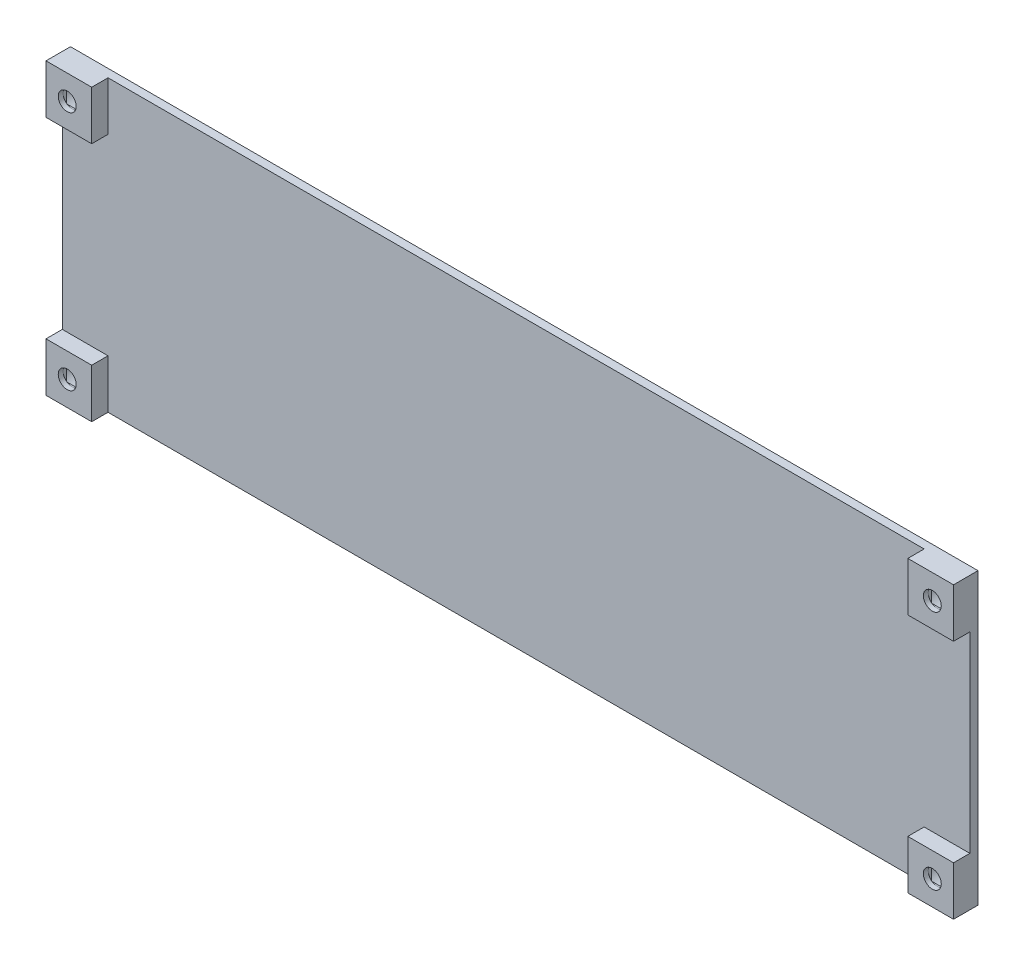
from build123d import *
from build123d.topology import SkipClean

# Parameters (mm, degrees)
SKETCH1_W               = 112
SKETCH1_H               = 35.5
BOSS_EXTRUDE1_DEPTH     = 1
SKETCH2_W               = 6
SKETCH2_H               = 6
BOSS_EXTRUDE2_DEPTH     = 2
SKETCH3_R               = 1.1
CUT_EXTRUDE1_DEPTH      = 59.822295943
SKETCH4_R               = 2
CUT_EXTRUDE2_DEPTH      = 2
CUT_EXTRUDE3_DEPTH      = 0.2
SKETCH6_W               = 2.2
SKETCH6_H               = 2.2
CUT_EXTRUDE4_DEPTH      = 0.2
MIRROR2_COPY_1_DEPTH    = 0.2
MIRROR2_COPY_2_SKETCH_W = 2.2
MIRROR2_COPY_2_SKETCH_H = 2.2
MIRROR2_COPY_2_DEPTH    = 0.2
SKETCH7_W               = 0.4
SKETCH7_H               = 35.5
CUT_EXTRUDE5_DEPTH      = 59.822295943
CUT_EXTRUDE6_DEPTH      = 0.2
BOSS_EXTRUDE3_DEPTH     = 0.2


with BuildPart() as part:
    # Sketch1 → Boss-Extrude1 (new body)
    with BuildSketch(Plane.XY):
        Rectangle(SKETCH1_W, SKETCH1_H)
    extrude(amount=BOSS_EXTRUDE1_DEPTH)

    # Sketch2 → Boss-Extrude2 (add)
    with BuildSketch(Plane.XY.offset(1)):
        with Locations((-53, 14.75)):
            Rectangle(SKETCH2_W, SKETCH2_H)
        with Locations((-53, -14.75)):
            Rectangle(SKETCH2_W, SKETCH2_H)
        with Locations((53, -14.75)):
            Rectangle(SKETCH2_W, SKETCH2_H)
        with Locations((53, 14.75)):
            Rectangle(SKETCH2_W, SKETCH2_H)
    extrude(amount=BOSS_EXTRUDE2_DEPTH)

    # Sketch3 → Cut-Extrude1 (cut, through all)
    with BuildSketch(Plane.XY.offset(3)):
        with Locations((-53, 14.75)):
            Circle(SKETCH3_R)
        with Locations(Location((-53, -14.75, 0), (0, 0, 180))):
            Circle(SKETCH3_R)
        with Locations((53, -14.75)):
            Circle(SKETCH3_R)
        with Locations(Location((53, 14.75, 0), (0, 0, 180))):
            Circle(SKETCH3_R)
    extrude(amount=-CUT_EXTRUDE1_DEPTH, mode=Mode.SUBTRACT)

    # Sketch4 → Cut-Extrude2 (cut)
    with BuildSketch(Plane(origin=(0, 0, 0), x_dir=(-1, 0, 0), z_dir=(0, 0, -1))):
        with Locations((-53, 14.75)):
            Circle(SKETCH4_R)
        with Locations((-53, -14.75)):
            Circle(SKETCH4_R)
        with Locations((53, 14.75)):
            Circle(SKETCH4_R)
        with Locations((53, -14.75)):
            Circle(SKETCH4_R)
    extrude(amount=-CUT_EXTRUDE2_DEPTH, mode=Mode.SUBTRACT)

    # Sketch5 → Cut-Extrude3 (cut)
    with SkipClean():  # the faces are left unmerged after this step: merging them gives an invalid solid
        with BuildSketch(Plane(origin=(0, 0, 2), x_dir=(-1, 0, 0), z_dir=(0, 0, -1))):
            with BuildLine():
                Line((-54.1, 13.079670691), (-54.1, 16.420329309))
                ThreePointArc((-54.1, 16.420329309), (-53, 16.75), (-51.9, 16.420329309))
                Line((-51.9, 16.420329309), (-51.9, 13.079670691))
                ThreePointArc((-51.9, 13.079670691), (-53, 12.75), (-54.1, 13.079670691))
            make_face()
        cut_extrude3 = extrude(amount=-CUT_EXTRUDE3_DEPTH, mode=Mode.SUBTRACT)

    # Sketch6 → Cut-Extrude4 (cut)
    with SkipClean():  # the faces are left unmerged after this step: merging them gives an invalid solid
        with BuildSketch(Plane(origin=(0, 0, 2.2), x_dir=(-1, 0, 0), z_dir=(0, 0, -1))):
            with Locations((-53, 14.75)):
                Rectangle(SKETCH6_W, SKETCH6_H)
        cut_extrude4 = extrude(amount=-CUT_EXTRUDE4_DEPTH, mode=Mode.SUBTRACT)

    # Mirror1: Cut-Extrude3, Cut-Extrude4 across plane
    with SkipClean():  # the faces are left unmerged after this step: merging them gives an invalid solid
        add(cut_extrude3.mirror(Plane(origin=(0, 0, 0), x_dir=(0, 0, 1), z_dir=(1, 0, 0))), mode=Mode.SUBTRACT)
        add(cut_extrude4.mirror(Plane(origin=(0, 0, 0), x_dir=(0, 0, 1), z_dir=(1, 0, 0))), mode=Mode.SUBTRACT)

    # Mirror2: Cut-Extrude3, Cut-Extrude4 across plane
    with SkipClean():  # the faces are left unmerged after this step: merging them gives an invalid solid
        add(cut_extrude3.mirror(Plane.ZX), mode=Mode.SUBTRACT)
        add(cut_extrude4.mirror(Plane.ZX), mode=Mode.SUBTRACT)

    # Mirror2 copy 1 sketch → Mirror2 copy 1 (cut)
    with SkipClean():  # the faces are left unmerged after this step: merging them gives an invalid solid
        with BuildSketch(Plane(origin=(0, 0, 2), x_dir=(1, 0, 0), z_dir=(0, 0, -1))):
            with BuildLine():
                Line((-54.1, 13.079670691), (-54.1, 16.420329309))
                ThreePointArc((-54.1, 16.420329309), (-53, 16.75), (-51.9, 16.420329309))
                Line((-51.9, 16.420329309), (-51.9, 13.079670691))
                ThreePointArc((-51.9, 13.079670691), (-53, 12.75), (-54.1, 13.079670691))
            make_face()
        extrude(amount=-MIRROR2_COPY_1_DEPTH, mode=Mode.SUBTRACT)

    # Mirror2 copy 2 sketch → Mirror2 copy 2 (cut)
    with SkipClean():  # the faces are left unmerged after this step: merging them gives an invalid solid
        with BuildSketch(Plane(origin=(0, 0, 2.2), x_dir=(1, 0, 0), z_dir=(0, 0, -1))):
            with Locations((-53, 14.75)):
                Rectangle(MIRROR2_COPY_2_SKETCH_W, MIRROR2_COPY_2_SKETCH_H)
        extrude(amount=-MIRROR2_COPY_2_DEPTH, mode=Mode.SUBTRACT)

    # Sketch7 → Cut-Extrude5 (cut, through all)
    with SkipClean():  # the faces are left unmerged after this step: merging them gives an invalid solid
        with BuildSketch(Plane(origin=(0, 0, 0), x_dir=(-1, 0, 0), z_dir=(0, 0, -1))):
            with Locations((-55.8, 0)):
                Rectangle(SKETCH7_W, SKETCH7_H)
            with Locations((55.8, 0)):
                Rectangle(SKETCH7_W, SKETCH7_H)
        extrude(amount=-CUT_EXTRUDE5_DEPTH, mode=Mode.SUBTRACT)

    # Sketch8 → Cut-Extrude6 (cut)
    with SkipClean():  # the faces are left unmerged after this step: merging them gives an invalid solid
        with BuildSketch(Plane(origin=(0, 0, 0), x_dir=(-1, 0, 0), z_dir=(0, 0, -1))):
            with BuildLine():
                Line((-2.604324305, -9.891501976), (8.601209292, -9.891501976))
                Line((8.601209292, -9.891501976), (8.601209292, -14.75))
                Line((8.601209292, -14.75), (-10.711043672, -14.75))
                Line((-10.711043672, -14.75), (-10.711043672, -11.153162055))
                Line((-10.711043672, -11.153162055), (-2.261241301, -1.668577075))
                add(Edge.make_bspline(
                    [(-2.261241301, -1.668577075), (-2.085606024, -1.469721428), (-1.747196494, -1.086571484), (-1.26273649, -0.524939835), (-0.820519867, 0.00348011), (-0.424137088, 0.502859172), (-0.060436118, 0.962800115), (0.259477804, 1.392258983), (0.537162731, 1.790373883), (0.846303308, 2.273354463), (1.162679764, 2.861450984), (1.440070213, 3.583185441), (1.605856347, 4.318641737), (1.62863188, 4.814155409), (1.63994447, 5.06027668)],
                    knots=[0, 0, 0, 0, 1.200864758, 2.313795308, 3.357095411, 4.319347324, 5.199503106, 6.011013884, 6.742857061, 7.395987705, 8.606075009, 9.758149685, 10.886474627, 12, 12, 12, 12], degree=3))
                add(Edge.make_bspline(
                    [(1.63994447, 5.06027668), (1.631025985, 5.323298553), (1.613978056, 5.826072091), (1.437371551, 6.539501008), (1.148950539, 7.172678395), (0.739237801, 7.711913692), (0.240150599, 8.158799493), (-0.358923879, 8.471969991), (-1.035552196, 8.666323417), (-1.514668572, 8.685764461), (-1.763217585, 8.695849802)],
                    knots=[0, 0, 0, 0, 1.122071611, 2.144870723, 3.118210402, 4.075133995, 5.019081199, 5.957085754, 6.94020671, 8, 8, 8, 8], degree=3))
                add(Edge.make_bspline(
                    [(-1.763217585, 8.695849802), (-2.025033069, 8.683157165), (-2.541877251, 8.658100908), (-3.287950158, 8.422197863), (-3.984655431, 8.051937394), (-4.623493764, 7.533533805), (-5.20227581, 6.885247764), (-5.702237454, 6.107138386), (-6.140567651, 5.212830107), (-6.354928954, 4.559863975), (-6.466774898, 4.21916996)],
                    knots=[0, 0, 0, 0, 0.898035682, 1.772792474, 2.663678113, 3.597698099, 4.58577145, 5.639446461, 6.768348889, 8, 8, 8, 8], degree=3))
                Line((-6.466774898, 4.21916996), (-10.827249206, 6.748023715))
                add(Edge.make_bspline(
                    [(-10.827249206, 6.748023715), (-10.738562091, 7.024087536), (-10.563841389, 7.567955321), (-10.244974349, 8.349957305), (-9.866502499, 9.078281859), (-9.436701369, 9.754468806), (-8.970014306, 10.391211888), (-8.437041215, 10.966733231), (-7.863914991, 11.501363015), (-7.23514178, 11.975098245), (-6.573725879, 12.398619917), (-5.886034496, 12.773709499), (-5.169531885, 13.081663385), (-4.430154984, 13.338567605), (-3.663934571, 13.537282512), (-2.872608397, 13.681647018), (-2.056475215, 13.765383818), (-1.505172067, 13.775905846), (-1.226458692, 13.781225296)],
                    knots=[0, 0, 0, 0, 1.084001669, 2.135569902, 3.153578544, 4.148617366, 5.129402777, 6.100928853, 7.077119941, 8.056546318, 9.039947421, 10.012060905, 10.982018817, 11.952663112, 12.936330237, 13.938799445, 14.957952324, 16, 16, 16, 16], degree=3))
                add(Edge.make_bspline(
                    [(-1.226458692, 13.781225296), (-1.006890174, 13.777950892), (-0.574552384, 13.771503479), (0.063454447, 13.72312113), (0.677584074, 13.63095646), (1.272421369, 13.519112772), (1.842817293, 13.361849334), (2.392090431, 13.174254571), (2.919123239, 12.952478626), (3.585937725, 12.615542543), (4.356869843, 12.119757597), (5.181659299, 11.417350389), (5.886263126, 10.605724429), (6.466863479, 9.693783938), (6.924985704, 8.700755677), (7.262410454, 7.638687084), (7.456495672, 6.506123076), (7.481639389, 5.728733687), (7.494489924, 5.331422925)],
                    knots=[0, 0, 0, 0, 0.771070178, 1.518263086, 2.244699342, 2.951016748, 3.642414607, 4.320453822, 4.988141637, 5.648626705, 6.942316379, 8.196432467, 9.440740914, 10.702129428, 11.980189253, 13.27082662, 14.605164968, 16, 16, 16, 16], degree=3))
                add(Edge.make_bspline(
                    [(7.494489924, 5.331422925), (7.481496961, 4.935595682), (7.455727095, 4.150523436), (7.223331957, 2.995977534), (6.858911435, 1.881439014), (6.425822998, 0.9864406), (6.000169393, 0.271324701), (5.619024636, -0.305203677), (5.190971388, -0.925595447), (4.692785104, -1.577083582), (4.146925263, -2.274154831), (3.544255088, -3.008998869), (2.88240986, -3.780823359), (2.417357765, -4.303329688), (2.176703363, -4.573715415)],
                    knots=[0, 0, 0, 0, 1.235362682, 2.45018243, 3.663730637, 4.890503398, 5.546674873, 6.262660812, 7.049097853, 7.900739459, 8.82406104, 9.814907832, 10.869262055, 12, 12, 12, 12], degree=3))
                Line((2.176703363, -4.573715415), (-2.604324305, -9.891501976))
            make_face()
        extrude(amount=-CUT_EXTRUDE6_DEPTH, mode=Mode.SUBTRACT)

    # Sketch9 → Boss-Extrude3 (add)
    with SkipClean():  # the faces are left unmerged after this step: merging them gives an invalid solid
        with BuildSketch(Plane(origin=(0, 0, 0.2), x_dir=(-1, 0, 0), z_dir=(0, 0, -1))):
            with BuildLine():
                Line((-2.828704261, -9.991501976), (2.102005183, -4.507230967))
                add(Edge.make_bspline(
                    [(2.102005183, -4.507230967), (2.419846669, -4.150122182), (2.737497276, -3.792849905), (3.361572546, -3.068690099), (3.668478407, -2.702214725), (4.26948051, -1.958292274), (4.564235105, -1.581963642), (5.141954723, -0.820713138), (5.415760218, -0.428964854), (5.944217444, 0.368683662), (6.193154908, 0.775924676), (6.623865769, 1.621534014), (6.806925817, 2.059796172), (7.02820012, 2.742707854), (7.093527831, 2.974323714), (7.206050825, 3.438264528), (7.253166698, 3.671542593), (7.360973631, 4.376172493), (7.378753272, 4.85365988), (7.394436854, 5.331446966)],
                    knots=[0, 0, 0, 0, 0.125, 0.125, 0.25, 0.25, 0.375, 0.375, 0.5, 0.5, 0.625, 0.625, 0.75, 0.75, 0.8125, 0.8125, 0.875, 0.875, 1, 1, 1, 1], degree=3))
                add(Edge.make_bspline(
                    [(7.394436854, 5.331446966), (7.385333466, 5.612899484), (7.37619151, 5.894345423), (7.338028014, 6.453846891), (7.307638757, 6.731669157), (7.17195112, 7.557543208), (7.024228648, 8.099607027), (6.617320569, 9.159603482), (6.365844545, 9.662228132), (5.754670768, 10.605788688), (5.388332241, 11.049141674), (4.573373092, 11.821481589), (4.124467676, 12.158965217), (3.150448127, 12.74436706), (2.639417032, 12.98021643), (1.842082841, 13.255820898), (1.571810851, 13.336563043), (1.019270209, 13.468346135), (0.741012899, 13.517678002), (0.183277032, 13.603789772), (-0.096817949, 13.635707612), (-0.660010146, 13.672291666), (-0.943103992, 13.676988477), (-1.226250082, 13.681211066)],
                    knots=[0, 0, 0, 0, 0.0625, 0.0625, 0.125, 0.125, 0.25, 0.25, 0.375, 0.375, 0.5, 0.5, 0.625, 0.625, 0.75, 0.75, 0.8125, 0.8125, 0.875, 0.875, 0.9375, 0.9375, 1, 1, 1, 1], degree=3))
                add(Edge.make_bspline(
                    [(-1.226250082, 13.681211066), (-1.490397151, 13.676169579), (-1.754539776, 13.671101221), (-2.279522754, 13.640996965), (-2.540293371, 13.615539408), (-3.317699293, 13.509502511), (-3.829695955, 13.400875136), (-4.587618962, 13.177032756), (-4.83962602, 13.091124791), (-5.333726154, 12.901838161), (-5.575810585, 12.798835986), (-6.047318052, 12.571518192), (-6.276646425, 12.447043222), (-6.725857998, 12.182193834), (-6.945772718, 12.041872475), (-7.375385221, 11.744031166), (-7.58514363, 11.58661327), (-7.990071964, 11.247220085), (-8.18555856, 11.064545991), (-8.558254771, 10.689259528), (-8.736540207, 10.495490373), (-9.068357091, 10.089144261), (-9.222353719, 9.876920745), (-9.517009377, 9.442339958), (-9.657293132, 9.219697557), (-9.919360841, 8.760356816), (-10.041435451, 8.523092522), (-10.262623137, 8.041380005), (-10.362329215, 7.796198373), (-10.544156131, 7.298849036), (-10.626180427, 7.046642978), (-10.707398617, 6.794116679)],
                    knots=[0, 0, 0, 0, 0.0625, 0.0625, 0.125, 0.125, 0.25, 0.25, 0.3125, 0.3125, 0.375, 0.375, 0.4375, 0.4375, 0.5, 0.5, 0.5625, 0.5625, 0.625, 0.625, 0.6875, 0.6875, 0.75, 0.75, 0.8125, 0.8125, 0.875, 0.875, 0.9375, 0.9375, 1, 1, 1, 1], degree=3))
                Line((-10.707398617, 6.794116679), (-6.52327699, 4.367538528))
                add(Edge.make_bspline(
                    [(-6.52327699, 4.367538528), (-6.432075892, 4.644460527), (-6.339021851, 4.920494142), (-6.124820468, 5.459092181), (-6.002750018, 5.721214026), (-5.73076867, 6.232109753), (-5.581981282, 6.481422298), (-5.248234425, 6.962704865), (-5.064190019, 7.190955894), (-4.664142338, 7.612580853), (-4.447968218, 7.808026202), (-3.975324073, 8.158482039), (-3.725110776, 8.306986447), (-3.197408117, 8.55152242), (-2.916937624, 8.650140382), (-2.346880158, 8.767166478), (-2.055283778, 8.781808074), (-1.763612314, 8.795948109)],
                    knots=[0, 0, 0, 0, 0.125, 0.125, 0.25, 0.25, 0.375, 0.375, 0.5, 0.5, 0.625, 0.625, 0.75, 0.75, 0.875, 0.875, 1, 1, 1, 1], degree=3))
                add(Edge.make_bspline(
                    [(-1.763612314, 8.795948109), (-1.523416259, 8.786201705), (-1.283235385, 8.776361778), (-0.811378184, 8.70429074), (-0.578365592, 8.640724195), (-0.127105807, 8.464206975), (0.08604305, 8.354089836), (0.481317879, 8.079523953), (0.663048893, 7.914206273), (0.985313397, 7.556775979), (1.129480801, 7.360157631), (1.368307281, 6.939026517), (1.462664908, 6.718031271), (1.611361595, 6.259382587), (1.664569485, 6.020771803), (1.723640583, 5.542571284), (1.73183537, 5.301123263), (1.740022363, 5.059674385)],
                    knots=[0, 0, 0, 0, 0.125, 0.125, 0.25, 0.25, 0.375, 0.375, 0.5, 0.5, 0.625, 0.625, 0.75, 0.75, 0.875, 0.875, 1, 1, 1, 1], degree=3))
                add(Edge.make_bspline(
                    [(1.740022363, 5.059674385), (1.732309953, 4.891880082), (1.724609304, 4.724083452), (1.696170685, 4.391070472), (1.674526776, 4.226033422), (1.580540955, 3.736672514), (1.483375516, 3.417261604), (1.106116049, 2.47600269), (0.751413064, 1.910757432), (0.167581062, 1.09715248), (-0.036771099, 0.831928988), (-0.452100539, 0.306229607), (-0.660204767, 0.043749217), (-1.300606056, -0.730173324), (-1.74312769, -1.233024168), (-2.186574923, -1.735097238)],
                    knots=[0, 0, 0, 0, 0.0625, 0.0625, 0.125, 0.125, 0.25, 0.25, 0.5, 0.5, 0.625, 0.625, 0.75, 0.75, 1, 1, 1, 1], degree=3))
                Line((-2.186574923, -1.735097238), (-10.611043672, -11.191246181))
                Line((-10.611043672, -11.191246181), (-10.611043672, -14.65))
                Line((-10.611043672, -14.65), (8.501209292, -14.65))
                Line((8.501209292, -14.65), (8.501209292, -9.991501976))
                Line((8.501209292, -9.991501976), (-2.828704261, -9.991501976))
            make_face()
        extrude(amount=BOSS_EXTRUDE3_DEPTH)


solid = part.part
